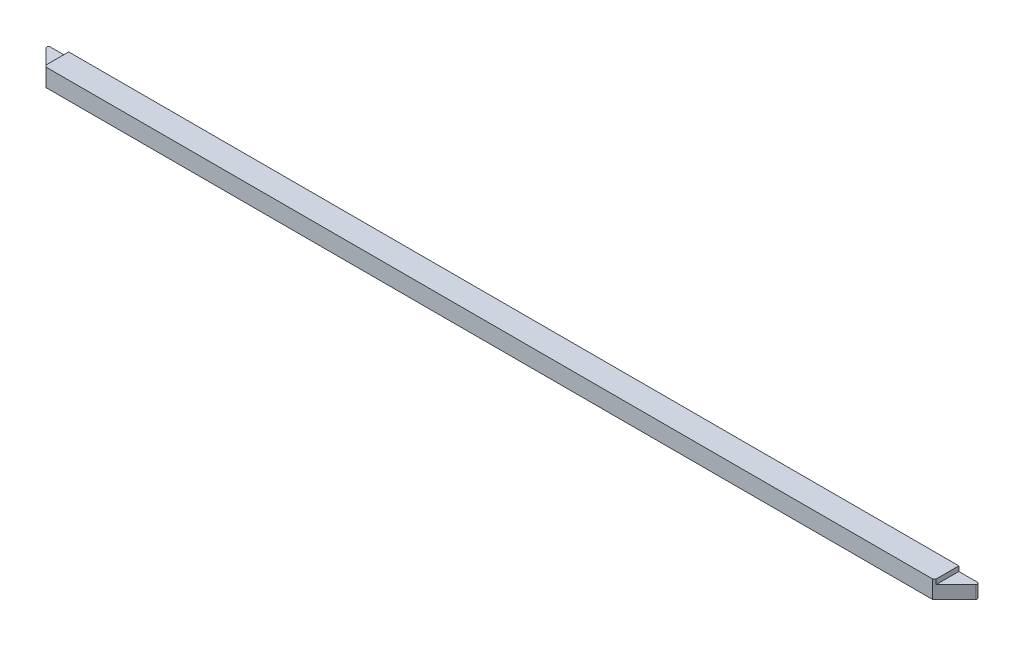
from build123d import *

# Parameters (mm, degrees)
ESQUISSE1_W        = 200
ESQUISSE1_H        = 5.5
BOSS_EXTRU_1_DEPTH = 4
CHANFREIN1_SIZE    = 0.4
BOSS_EXTRU_2_DEPTH = 2.9
CONG_1_R           = 0.4


with BuildPart() as part:
    # Esquisse1 → Boss.-Extru.1 (new body)
    with BuildSketch(Plane(origin=(0, 0, 0), x_dir=(1, 0, 0), z_dir=(0, 1, 0))):
        with Locations((100, 2.75)):
            Rectangle(ESQUISSE1_W, ESQUISSE1_H)
    extrude(amount=BOSS_EXTRU_1_DEPTH)

    # Chanfrein1
    chanfrein1_edges = [part.edges().sort_by_distance(p)[0] for p in [
        (200, 2, 0),
        (0, 2, 0),
    ]]
    chamfer(chanfrein1_edges, length=CHANFREIN1_SIZE)

    # Esquisse2 → Boss.-Extru.2 (add)
    with BuildSketch(Plane(origin=(0, 0, 0), x_dir=(1, 0, 0), z_dir=(0, 1, 0))):
        Polygon((0, 5.5), (-5.1, 5.5), (0, 0.4), align=None)
    boss_extru_2 = extrude(amount=BOSS_EXTRU_2_DEPTH)

    # Symétrie1: Boss.-Extru.2 across plane
    add(boss_extru_2.mirror(Plane.ZY.offset(-100)))

    # Congé1
    cong_1_edges = [part.edges().sort_by_distance(p)[0] for p in [
        (-5.1, 1.45, -5.5),
        (205.1, 1.45, -5.5),
    ]]
    fillet(cong_1_edges, radius=CONG_1_R)


solid = part.part
